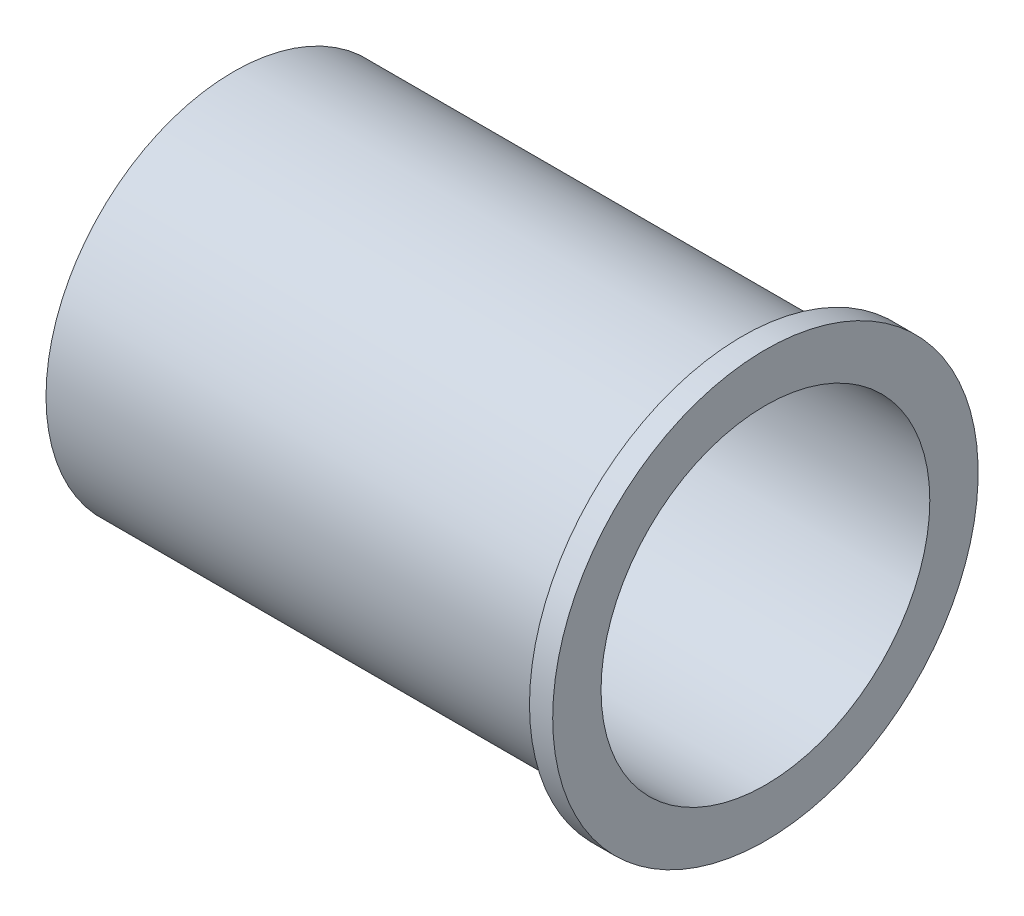
from build123d import *


with BuildPart() as part:
    # Sketch1 → Revolve1 (revolve)
    with BuildSketch(Plane.XY, mode=Mode.PRIVATE) as revolve1_sk:
        Polygon((-137.5, 42.5), (0, 42.5), (0, 55), (-6, 55), (-6, 48.5), (-137.5, 48.5), align=None)
    revolve(revolve1_sk.sketch.rotate(Axis((-94.889937107, 0, 0), (1, 0, 0)), 90), axis=Axis((-94.889937107, 0, 0), (1, 0, 0)))


solid = part.part
